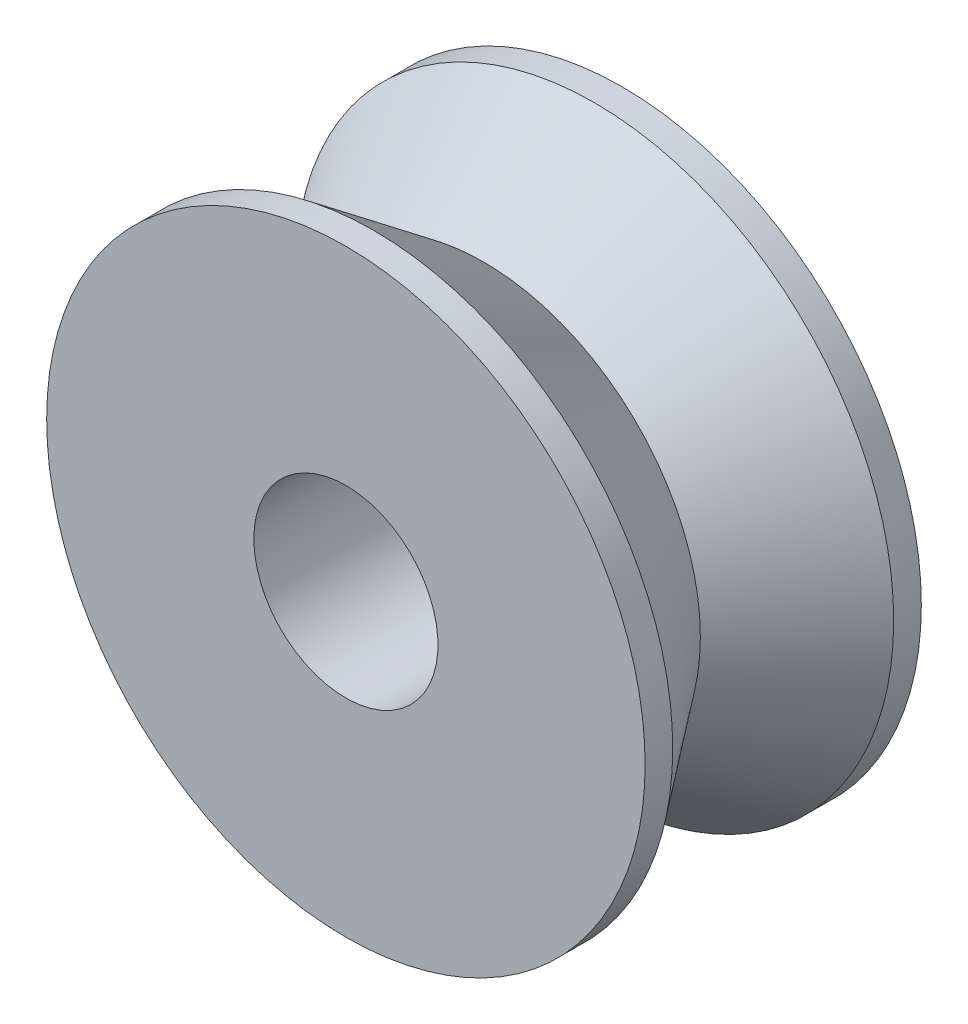
from build123d import *


with BuildPart() as part:
    # 草图1 → 旋转1 (revolve)
    with BuildSketch(Plane(origin=(0, 0, 0), x_dir=(0, 0, -1), z_dir=(1, 0, 0)), mode=Mode.PRIVATE) as revolve_1_sk:
        Polygon((-3, 2), (3, 2), (3, 6.5), (2.4, 6.5), (0, 4.7), (-2.4, 6.5), (-3, 6.5), align=None)
    revolve(revolve_1_sk.sketch.rotate(Axis((0, 0, 0), (0, 0, 1)), 90), axis=Axis((0, 0, 0), (0, 0, 1)))


solid = part.part
